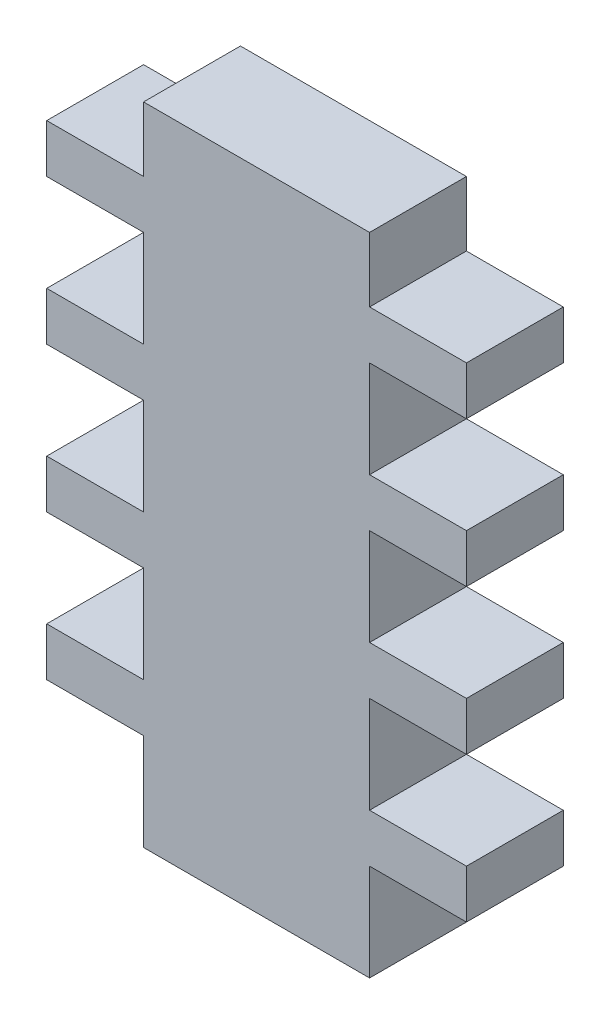
from build123d import *

# Parameters (mm, degrees)
SKETCH1_W           = 13
SKETCH1_H           = 20
BOSS_EXTRUDE1_DEPTH = 3
SKETCH2_W           = 3
SKETCH2_H           = 2
SKETCH2_H_2         = 3
CUT_EXTRUDE1_DEPTH  = 3
SKETCH3_W           = 3
SKETCH3_H           = 2
SKETCH3_H_2         = 3
CUT_EXTRUDE2_DEPTH  = 3


with BuildPart() as part:
    # Sketch1 → Boss-Extrude1 (new body)
    with BuildSketch(Plane.XY):
        Rectangle(SKETCH1_W, SKETCH1_H)
    extrude(amount=BOSS_EXTRUDE1_DEPTH)

    # Sketch2 → Cut-Extrude1 (cut)
    with BuildSketch(Plane.XY.offset(3)):
        with Locations((-5, 9)):
            Rectangle(SKETCH2_W, SKETCH2_H)
        with Locations((-5, 5)):
            Rectangle(SKETCH2_W, SKETCH2_H_2)
        with Locations((-5, 0.5)):
            Rectangle(SKETCH2_W, SKETCH2_H_2)
        with Locations((-5, -4)):
            Rectangle(SKETCH2_W, SKETCH2_H_2)
        with Locations((-5, -8.5)):
            Rectangle(SKETCH2_W, SKETCH2_H_2)
    extrude(amount=-CUT_EXTRUDE1_DEPTH, mode=Mode.SUBTRACT)

    # Sketch3 → Cut-Extrude2 (cut)
    with BuildSketch(Plane.XY.offset(3)):
        with Locations((5, 9)):
            Rectangle(SKETCH3_W, SKETCH3_H)
        with Locations((5, 5)):
            Rectangle(SKETCH3_W, SKETCH3_H_2)
        with Locations((5, 0.5)):
            Rectangle(SKETCH3_W, SKETCH3_H_2)
        with Locations((5, -4)):
            Rectangle(SKETCH3_W, SKETCH3_H_2)
        with Locations((5, -8.5)):
            Rectangle(SKETCH3_W, SKETCH3_H_2)
    extrude(amount=-CUT_EXTRUDE2_DEPTH, mode=Mode.SUBTRACT)


solid = part.part
